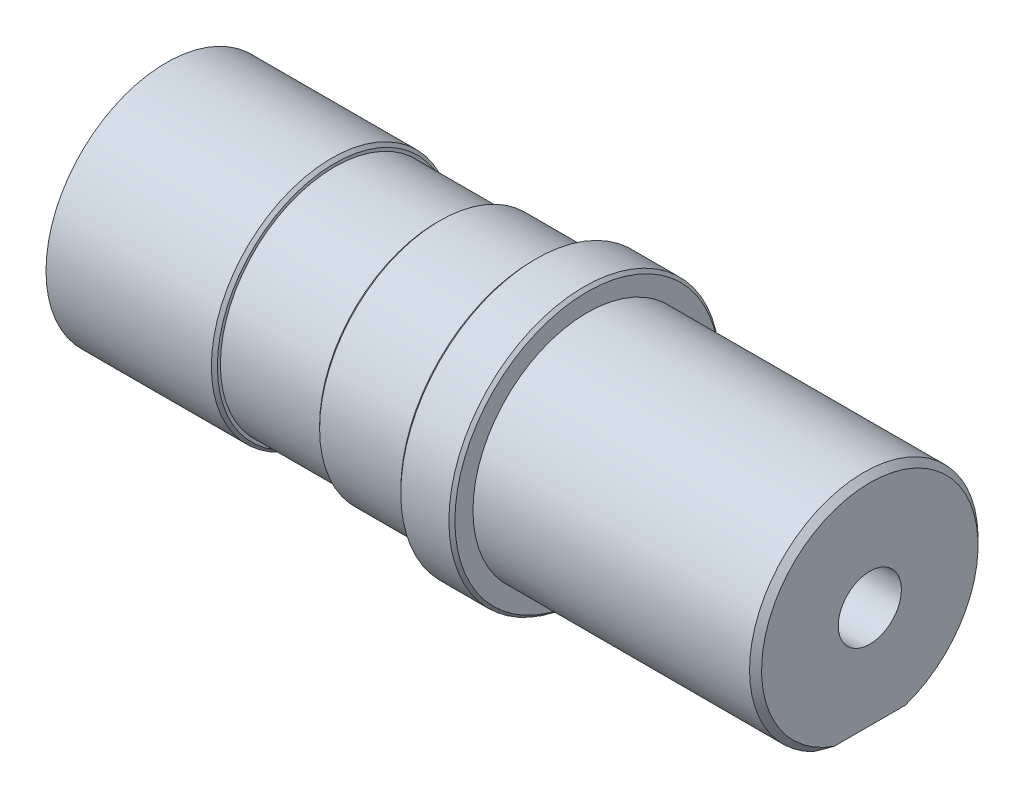
from build123d import *

# Parameters (mm, degrees)
CUT_EXTRUDE_1_DEPTH = 41
M12X1_5_1_D         = 10.5
M12X1_5_1_DEPTH     = 28.5
M12X1_5_1_TIP       = 3.15451825
CUT_EXTRUDE_2_DEPTH = 5


with BuildPart() as part:
    # 草图1 → 旋转1 (revolve)
    with BuildSketch(Plane.XY, mode=Mode.PRIVATE) as revolve_1_sk:
        Polygon((2043.973648654, 794.790077636), (2043.973648654, 776.790077638), (1926.973648645, 776.790077638), (1926.973648645, 796.790077638), (1954.473648645, 796.790077638), (1954.973648645, 796.290077638), (1954.973648645, 795.790077638), (1971.973648645, 795.790077638), (1971.973648645, 796.290077636), (1972.473648645, 796.790077636), (1987.973648648, 796.790077636), (1987.973648648, 798.790077633), (1988.47364865, 799.290077636), (1996.47364865, 799.290077636), (1996.973648654, 798.790077632), (1996.973648654, 795.790077636), (2042.973648654, 795.790077636), align=None)
    revolve(revolve_1_sk.sketch.rotate(Axis((1926.973648645, 776.790077638, 0), (1, 0, 0)), 90), axis=Axis((1926.973648645, 776.790077638, 0), (1, 0, 0)))

    # 草图5 → 切除-拉伸1 (cut)
    with BuildSketch(Plane(origin=(2043.973648654, 0, 0), x_dir=(0, 0, -1), z_dir=(1, 0, 0))):
        with BuildLine():
            Line((-8.485281368, 759.790077638), (8.485281368, 759.790077638))
            ThreePointArc((8.485281368, 759.790077638), (0, 757.790077641), (-8.485281368, 759.790077638))
        make_face()
    extrude(amount=-CUT_EXTRUDE_1_DEPTH, mode=Mode.SUBTRACT)

    # M12x1.5 螺纹孔1
    with Locations(Plane(origin=(2043.973648654, 16.946016644, 3.006019144), x_dir=(0, 0, -1), z_dir=(1, 0, 0))):
        with Locations((3.006019144, 759.844060994)):
            Hole(M12X1_5_1_D / 2, depth=M12X1_5_1_DEPTH)
            with Locations((0, 0, -(M12X1_5_1_DEPTH + M12X1_5_1_TIP / 2))):  # 118° drill point
                Cone(0, M12X1_5_1_D / 2, M12X1_5_1_TIP, mode=Mode.SUBTRACT)

    # 草图8 → 切除-拉伸2 (cut)
    with BuildSketch(Plane.XZ.offset(-759.790077638)):
        with BuildLine():
            Line((1937.973648645, 3.25), (1926.973648645, 3.25))
            Line((1926.973648645, 3.25), (1926.973648645, -3.25))
            Line((1926.973648645, -3.25), (1937.973648645, -3.25))
            ThreePointArc((1937.973648645, -3.25), (1941.223648645, 0), (1937.973648645, 3.25))
        make_face()
    extrude(amount=CUT_EXTRUDE_2_DEPTH, mode=Mode.SUBTRACT)


solid = part.part
